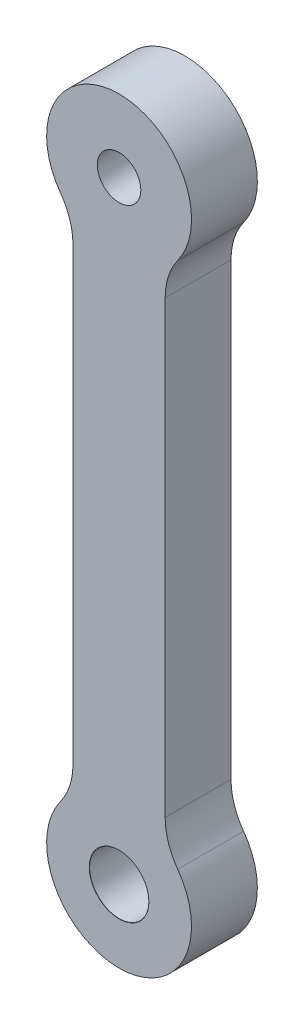
from build123d import *

# Parameters (mm, degrees)
BOSS_EXTRU_2_DEPTH         = 10
CONG_1_R                   = 10
D_GAGEMENT_M81_D           = 9
D_GAGEMENT_M81_CSINK_D     = 9.05
D_GAGEMENT_M81_CSINK_ANGLE = 90
D_GAGEMENT_M61_D           = 6.6


with BuildPart() as part:
    # Esquisse1 → Boss.-Extru.2 (new body)
    with BuildSketch(Plane.XY):
        with BuildLine():
            Line((-7, 38), (-7, -38))
            ThreePointArc((-7, -38), (0, -57.485281374), (7, -38))
            Line((7, -38), (7, 38))
            ThreePointArc((7, 38), (0, 57.485281374), (-7, 38))
        make_face()
    extrude(amount=BOSS_EXTRU_2_DEPTH)

    # Congé1
    cong_1_edges = [part.edges().sort_by_distance(p)[0] for p in [
        (7, 38, 5),
        (7, -38, 5),
        (-7, -38, 5),
        (-7, 38, 5),
    ]]
    fillet(cong_1_edges, radius=CONG_1_R)

    # Dégagement M81 (through all)
    with Locations(Plane.XY.offset(10)):
        with Locations((0, -46.485281374)):
            CounterSinkHole(D_GAGEMENT_M81_D / 2, D_GAGEMENT_M81_CSINK_D / 2, counter_sink_angle=D_GAGEMENT_M81_CSINK_ANGLE)

    # Dégagement M61 (through all)
    with Locations(Plane.XY.offset(10)):
        with Locations((0, 46.485281374)):
            Hole(D_GAGEMENT_M61_D / 2)


solid = part.part
